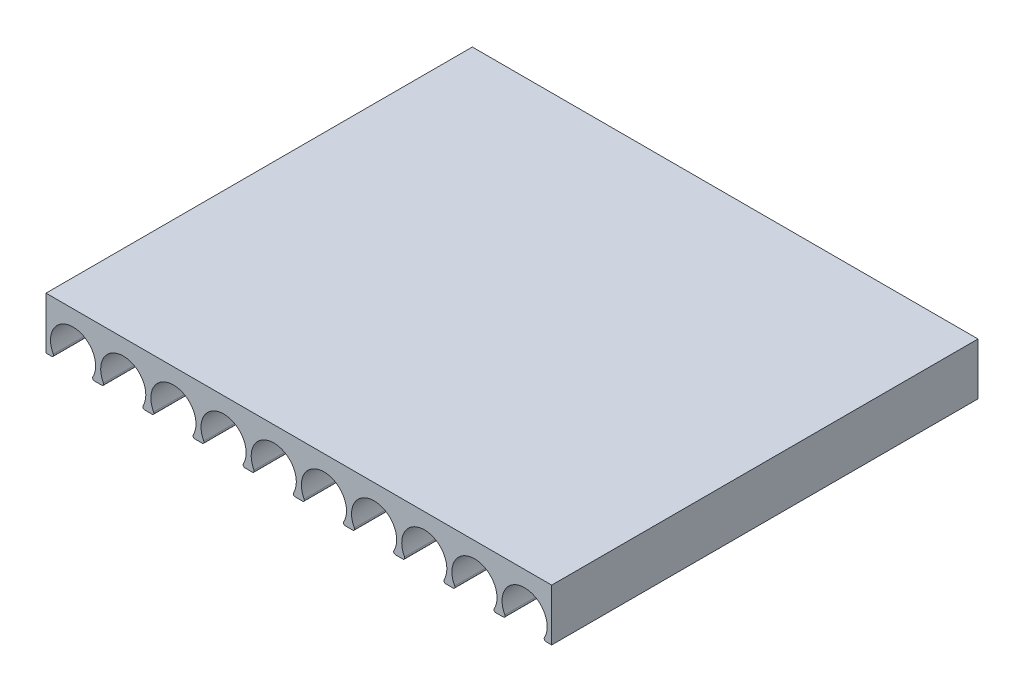
from build123d import *

# Parameters (mm, degrees)
BOSS_EXTRUDE1_DEPTH    = 30
FILLET1_R              = 0.254
LPATTERN1_COUNT        = 10
LPATTERN1_PITCH        = 7.0612
FILLET1_OF_LPATTERN1_R = 0.254
SKETCH4_W              = 71.1708
SKETCH4_H              = 60
BOSS_EXTRUDE2_DEPTH    = 1.5875


with BuildPart() as part:
    # Sketch1 → Boss-Extrude1 (new, symmetric)
    with BuildSketch(Plane.XY):
        with BuildLine():
            Line((0, 0), (1.27, 0))
            ThreePointArc((1.27, 0), (3.81, 5.08), (6.35, 0))
            Line((6.35, 0), (7.62, 0))
            Line((7.62, 0), (7.62, 5.715))
            Line((7.62, 5.715), (0, 5.715))
            Line((0, 5.715), (0, 0))
        make_face()
    boss_extrude1 = extrude(amount=BOSS_EXTRUDE1_DEPTH, both=True)

    # Fillet1
    fillet1_edges = [part.edges().sort_by_distance(p)[0] for p in [
        (6.35, 0, 0),
        (1.27, 0, 0),
    ]]
    fillet(fillet1_edges, radius=FILLET1_R)

    # LPattern1: Boss-Extrude1 ×10
    with Locations(*[(-i * LPATTERN1_PITCH, 0, 0) for i in range(1, LPATTERN1_COUNT)]):
        add(boss_extrude1)

    # Fillet1 of LPattern1
    fillet1_of_lpattern1_edges = [part.edges().sort_by_distance(p)[0] for p in [
        (-0.7112, 0, 0),
        (-5.7912, 0, 0),
        (-7.7724, 0, 0),
        (-12.8524, 0, 0),
        (-14.8336, 0, 0),
        (-19.9136, 0, 0),
        (-21.8948, 0, 0),
        (-26.9748, 0, 0),
        (-28.956, 0, 0),
        (-34.036, 0, 0),
        (-36.0172, 0, 0),
        (-41.0972, 0, 0),
        (-43.0784, 0, 0),
        (-48.1584, 0, 0),
        (-50.1396, 0, 0),
        (-55.2196, 0, 0),
        (-57.2008, 0, 0),
        (-62.2808, 0, 0),
    ]]
    fillet(fillet1_of_lpattern1_edges, radius=FILLET1_OF_LPATTERN1_R)

    # Sketch4 → Boss-Extrude2 (add)
    with BuildSketch(Plane(origin=(0, 5.715, 0), x_dir=(1, 0, 0), z_dir=(0, 1, 0))):
        with Locations((-27.9654, 0)):
            Rectangle(SKETCH4_W, SKETCH4_H)
    extrude(amount=BOSS_EXTRUDE2_DEPTH)


solid = part.part
